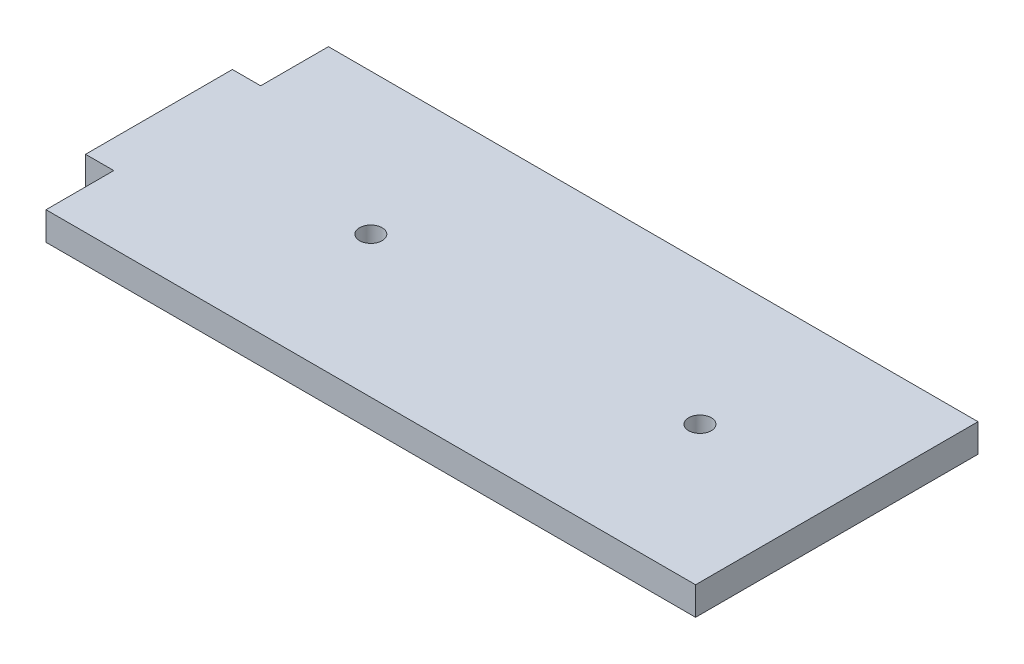
from build123d import *

# Parameters (mm, degrees)
SKETCH1_W           = 76.2
SKETCH1_H           = 31.75
BOSS_EXTRUDE1_DEPTH = 3.175
SKETCH2_R           = 1.27
SKETCH2_W           = 3.175
SKETCH2_H           = 7.62
CUT_EXTRUDE1_DEPTH  = 3.175


with BuildPart() as part:
    # Sketch1 → Boss-Extrude1 (new body)
    with BuildSketch(Plane(origin=(0, 0, 0), x_dir=(1, 0, 0), z_dir=(0, 1, 0))):
        Rectangle(SKETCH1_W, SKETCH1_H)
    extrude(amount=BOSS_EXTRUDE1_DEPTH)

    # Sketch2 → Cut-Extrude1 (cut)
    with BuildSketch(Plane(origin=(0, 3.175, 0), x_dir=(1, 0, 0), z_dir=(0, 1, 0))):
        with Locations(Location((-14.280312521, 0, 0), (0, 0, 270))):
            Circle(SKETCH2_R)
        with Locations(Location((22.719687479, 0, 0), (0, 0, 270))):
            Circle(SKETCH2_R)
        with Locations((-36.5125, 12.065)):
            Rectangle(SKETCH2_W, SKETCH2_H)
        with Locations((-36.5125, -12.065)):
            Rectangle(SKETCH2_W, SKETCH2_H)
    extrude(amount=-CUT_EXTRUDE1_DEPTH, mode=Mode.SUBTRACT)


solid = part.part
